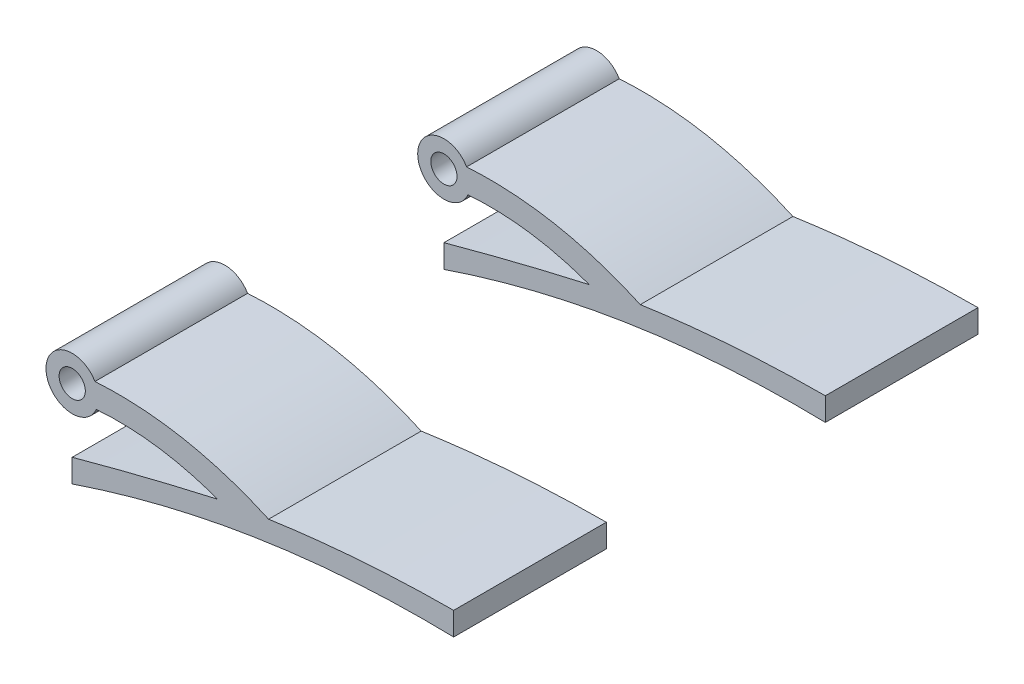
from build123d import *

# Parameters (mm, degrees)
SKETCH1_R               = 25.4
SKETCH1_R_2             = 12.7
BOSS_EXTRUDE1_DEPTH     = 254
BOSS_EXTRUDE2_DEPTH     = 254
CUT_EXTRUDE2_DEPTH      = 457.289621816
CUT_EXTRUDE2_DEPTH_BACK = 457.289621816
SKETCH4_W               = 419.69261594
SKETCH4_H               = 212.221573602


with BuildPart() as part:
    # Sketch1 → Boss-Extrude1 (new, symmetric)
    with BuildSketch(Plane.XY):
        Circle(SKETCH1_R)
        Circle(SKETCH1_R_2, mode=Mode.SUBTRACT)
    extrude(amount=BOSS_EXTRUDE1_DEPTH, both=True)

    # Sketch3 → Boss-Extrude2 (add, symmetric)
    with BuildSketch(Plane.XY):
        with BuildLine():
            Line((0, -61.872891468), (0, -84.279474595))
            add(Edge.make_bspline(
                [(0, -84.279474595), (179.154342515, -23.522142215), (369.568923203, -27.923523093)],
                knots=[0, 0, 0, 1, 1, 1], degree=2))
            Line((369.568923203, -27.923523093), (369.568923203, -5.516939966))
            add(Edge.make_bspline(
                [(190.2519953, -18.712944977), (278.712063384, -5.816566684), (369.568923203, -5.516939966)],
                knots=[0.521873105, 0.521873105, 0.521873105, 1, 1, 1], degree=2))
            add(Edge.make_bspline(
                [(21.997045256, 12.7), (108.775317236, 18.192473257), (190.2519953, -18.712944977)],
                knots=[0, 0, 0, 1, 1, 1], degree=2))
            ThreePointArc((21.997045256, 12.7), (25.357328272, 1.471700676), (23.318578458, -10.069950282))
            add(Edge.make_bspline(
                [(23.318578458, -10.069950282), (83.504990311, -5.482305261), (140.74929301, -26.657872419)],
                knots=[0, 0, 0, 1, 1, 1], degree=2))
            add(Edge.make_bspline(
                [(0, -61.872891468), (69.975789809, -42.626915469), (140.74929301, -26.657872419)],
                knots=[0, 0, 0, 1, 1, 1], degree=2))
        make_face()
    extrude(amount=BOSS_EXTRUDE2_DEPTH, both=True)

    # Sketch4 → Cut-Extrude2 (cut, two sides: drawn at the far end of the back side and taken through both)
    with BuildSketch(Plane(origin=(0, 0, 0), x_dir=(1, 0, 0), z_dir=(0, 1, 0)).offset(-CUT_EXTRUDE2_DEPTH_BACK)):
        with Locations((184.44630797, 0)):
            Rectangle(SKETCH4_W, SKETCH4_H)
    extrude(amount=CUT_EXTRUDE2_DEPTH + CUT_EXTRUDE2_DEPTH_BACK, mode=Mode.SUBTRACT)


with BuildPart() as cut_extrude2_piece_1:
    # of the separate pieces the step leaves, piece 1, a body of its own (cut_extrude2_pieces)
    add(part.part.solids().sort_by_distance((23.318578458, -10.069950282, -106.110786801))[0])


with BuildPart() as cut_extrude2_piece_2:
    # of the separate pieces the step leaves, piece 2, a body of its own (cut_extrude2_pieces)
    add(part.part.solids().sort_by_distance((21.997045256, 12.7, 106.110786801))[0])


solid = Compound([cut_extrude2_piece_1.part, cut_extrude2_piece_2.part])
